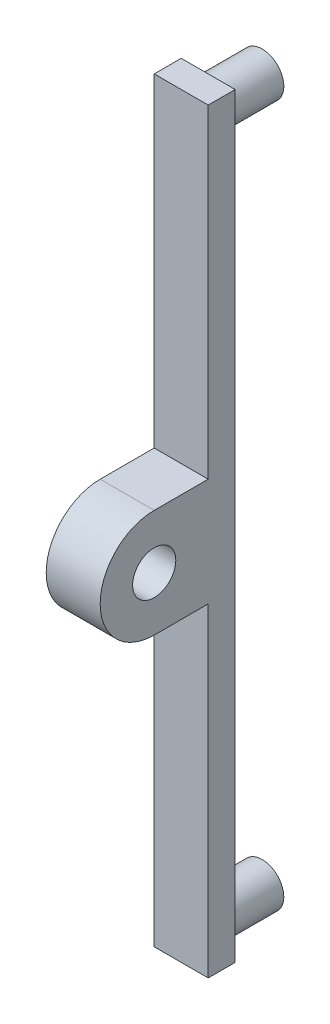
from build123d import *

# Parameters (mm, degrees)
SKETCH1_R           = 4
BOSS_EXTRUDE1_DEPTH = 10
SKETCH2_R           = 4
BOSS_EXTRUDE2_DEPTH = 10


with BuildPart() as part:
    # Sketch1 → Boss-Extrude1 (new body)
    with BuildSketch(Plane(origin=(0, 0, 0), x_dir=(0, 0, -1), z_dir=(1, 0, 0))):
        with BuildLine():
            Line((10, 70), (10, 10))
            Line((10, 10), (0, 10))
            ThreePointArc((0, 10), (-10, 0), (0, -10))
            Line((0, -10), (10, -10))
            Line((10, -10), (10, -70))
            Line((10, -70), (15, -70))
            Line((15, -70), (15, 70))
            Line((15, 70), (10, 70))
        make_face()
        Circle(SKETCH1_R, mode=Mode.SUBTRACT)
    extrude(amount=BOSS_EXTRUDE1_DEPTH)

    # Sketch2 → Boss-Extrude2 (add)
    with BuildSketch(Plane(origin=(0, 0, -15), x_dir=(-1, 0, 0), z_dir=(0, 0, -1))):
        with Locations((-5, 65)):
            Circle(SKETCH2_R)
        with Locations(Location((-5, -65, 0), (0, 0, 180))):
            Circle(SKETCH2_R)
    extrude(amount=BOSS_EXTRUDE2_DEPTH)


solid = part.part
